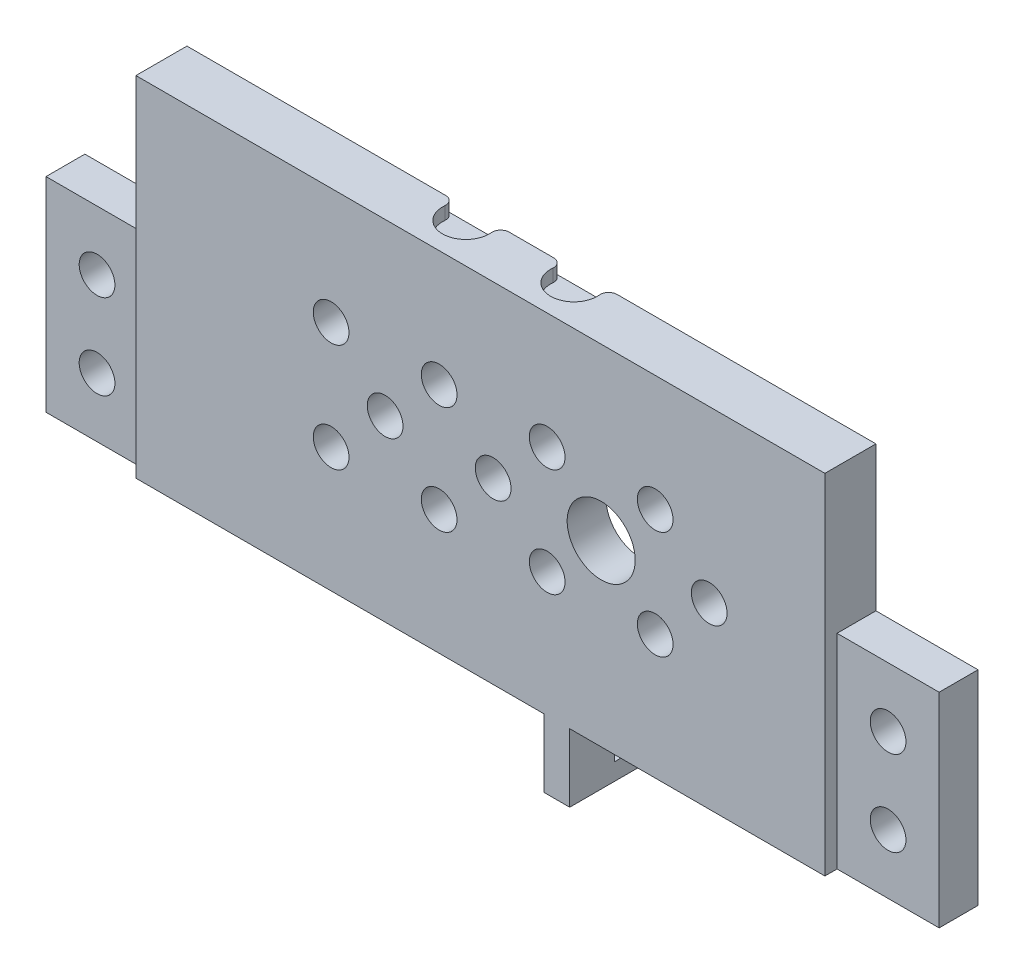
from build123d import *

# Parameters (mm, degrees)
SKETCH1_W           = 81
SKETCH1_H           = 41
BOSS_EXTRUDE1_DEPTH = 6
SKETCH5_W           = 75
SKETCH5_H           = 35
CUT_EXTRUDE1_DEPTH  = 1.43
SKETCH8_R           = 2.1
SKETCH8_R_2         = 4
CUT_EXTRUDE2_DEPTH  = 46.787552894
SKETCH9_R           = 2.75
CUT_EXTRUDE3_DEPTH  = 1.5
FILLET1_R           = 1
SKETCH10_W          = 4.57
SKETCH10_H          = 24
BOSS_EXTRUDE2_DEPTH = 12
SKETCH12_W          = 4.57
SKETCH12_H          = 24
BOSS_EXTRUDE3_DEPTH = 12
SKETCH13_R          = 2.1
CUT_EXTRUDE4_DEPTH  = 57.545423334
SKETCH14_W          = 3
SKETCH14_H          = 15
SKETCH14_H_2        = 6
BOSS_EXTRUDE4_DEPTH = 8
SKETCH15_W          = 10.5
SKETCH15_H          = 4
CUT_EXTRUDE5_DEPTH  = 71.75485849


with BuildPart() as part:
    # Sketch1 → Boss-Extrude1 (new body)
    with BuildSketch(Plane.XY):
        Rectangle(SKETCH1_W, SKETCH1_H)
    extrude(amount=BOSS_EXTRUDE1_DEPTH)

    # Sketch5 → Cut-Extrude1 (cut)
    with BuildSketch(Plane(origin=(0, 0, 0), x_dir=(-1, 0, 0), z_dir=(0, 0, -1))):
        Rectangle(SKETCH5_W, SKETCH5_H)
    extrude(amount=-CUT_EXTRUDE1_DEPTH, mode=Mode.SUBTRACT)

    # Sketch8 → Cut-Extrude2 (cut, through all)
    with BuildSketch(Plane.XY.offset(6)):
        with Locations((26.9, 0.5)):
            Circle(SKETCH8_R)
        with Locations((20.55, 6.849637785)):
            Circle(SKETCH8_R)
        with Locations((7.85, 6.849637785)):
            Circle(SKETCH8_R)
        with Locations((7.85, -5.849637785)):
            Circle(SKETCH8_R)
        with Locations((20.55, -5.849637785)):
            Circle(SKETCH8_R)
        with Locations((1.5, 0.5)):
            Circle(SKETCH8_R)
        with Locations((-4.85, 6.849637785)):
            Circle(SKETCH8_R)
        with Locations((-4.85, -5.849637785)):
            Circle(SKETCH8_R)
        with Locations((-11.2, 0.5)):
            Circle(SKETCH8_R)
        with Locations((-17.55, 6.849637785)):
            Circle(SKETCH8_R)
        with Locations((-17.55, -5.849637785)):
            Circle(SKETCH8_R)
        with Locations((14.2, 0.5)):
            Circle(SKETCH8_R_2)
    extrude(amount=-CUT_EXTRUDE2_DEPTH, mode=Mode.SUBTRACT)

    # Sketch9 → Cut-Extrude3 (cut)
    with BuildSketch(Plane(origin=(0, 20.5, 0), x_dir=(1, 0, 0), z_dir=(0, 1, 0))):
        with Locations((6.35, -1.35)):
            Circle(SKETCH9_R)
        with Locations((-6.35, -1.35)):
            Circle(SKETCH9_R)
    extrude(amount=-CUT_EXTRUDE3_DEPTH, mode=Mode.SUBTRACT)

    # Fillet1
    fillet1_edges = [part.edges().sort_by_distance(p)[0] for p in [
        (-8.74582971, 19.75, 0),
        (-3.95417029, 19.75, 0),
        (3.95417029, 19.75, 0),
        (8.74582971, 19.75, 0),
    ]]
    fillet(fillet1_edges, radius=FILLET1_R)

    # Sketch10 → Boss-Extrude2 (add)
    with BuildSketch(Plane.ZY.offset(40.5)):
        with Locations((2.285, -8.5)):
            Rectangle(SKETCH10_W, SKETCH10_H)
    extrude(amount=BOSS_EXTRUDE2_DEPTH)

    # Sketch12 → Boss-Extrude3 (add)
    with BuildSketch(Plane(origin=(40.5, 0, 0), x_dir=(0, 0, -1), z_dir=(1, 0, 0))):
        with Locations((-2.285, -8.5)):
            Rectangle(SKETCH12_W, SKETCH12_H)
    extrude(amount=BOSS_EXTRUDE3_DEPTH)

    # Sketch13 → Cut-Extrude4 (cut, through all)
    with BuildSketch(Plane.XY.offset(4.57)):
        with Locations((-46.5, -3.5)):
            Circle(SKETCH13_R)
        with Locations((-46.5, -13.5)):
            Circle(SKETCH13_R)
        with Locations((46.5, -3.5)):
            Circle(SKETCH13_R)
        with Locations((46.5, -13.5)):
            Circle(SKETCH13_R)
    extrude(amount=-CUT_EXTRUDE4_DEPTH, mode=Mode.SUBTRACT)

    # Sketch14 → Boss-Extrude4 (add)
    with BuildSketch(Plane.XZ.offset(20.5)):
        with Locations((9, -7.5)):
            Rectangle(SKETCH14_W, SKETCH14_H)
        with Locations((9, 3)):
            Rectangle(SKETCH14_W, SKETCH14_H_2)
    extrude(amount=BOSS_EXTRUDE4_DEPTH)

    # Sketch15 → Cut-Extrude5 (cut, through all)
    with BuildSketch(Plane(origin=(10.5, 0, 0), x_dir=(0, 0, -1), z_dir=(1, 0, 0))):
        with Locations((4.5, -24.5)):
            Rectangle(SKETCH15_W, SKETCH15_H)
    extrude(amount=-CUT_EXTRUDE5_DEPTH, mode=Mode.SUBTRACT)


solid = part.part
